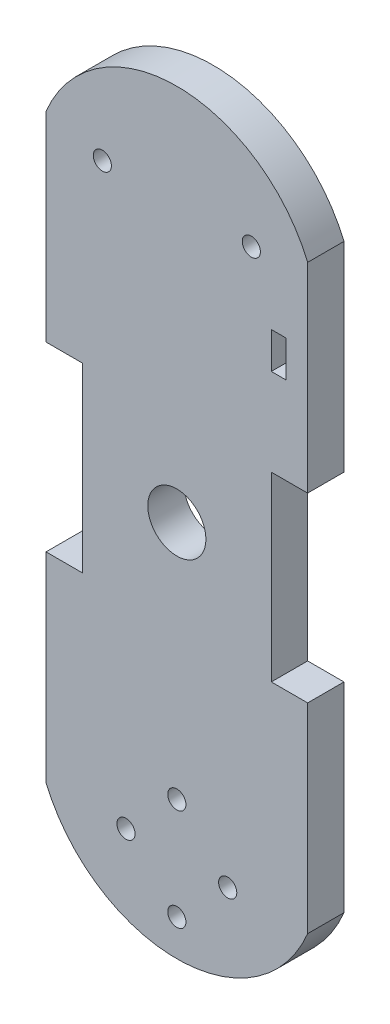
from build123d import *

# Parameters (mm, degrees)
SKETCH1_R           = 1.25
SKETCH1_R_2         = 4
SKETCH1_W           = 2
SKETCH1_H           = 5
BOSS_EXTRUDE1_DEPTH = 5


with BuildPart() as part:
    # Sketch1 → Boss-Extrude1 (new body)
    with BuildSketch(Plane.XY):
        with BuildLine():
            Line((-18, 80), (-18, 52.5))
            Line((-18, 52.5), (-13, 52.5))
            Line((-13, 52.5), (-13, 27.5))
            Line((-13, 27.5), (-18, 27.5))
            Line((-18, 27.5), (-18, 0))
            ThreePointArc((-18, 0), (0, -12), (18, 0))
            Line((18, 0), (18, 27.5))
            Line((18, 27.5), (13, 27.5))
            Line((13, 27.5), (13, 52.5))
            Line((13, 52.5), (18, 52.5))
            Line((18, 52.5), (18, 80))
            ThreePointArc((18, 80), (0, 92), (-18, 80))
        make_face()
        with Locations((0, 7)):
            Circle(SKETCH1_R, mode=Mode.SUBTRACT)
        with Locations((7, 0)):
            Circle(SKETCH1_R, mode=Mode.SUBTRACT)
        with Locations((0, -7)):
            Circle(SKETCH1_R, mode=Mode.SUBTRACT)
        with Locations((-7, 0)):
            Circle(SKETCH1_R, mode=Mode.SUBTRACT)
        with Locations((0, 40)):
            Circle(SKETCH1_R_2, mode=Mode.SUBTRACT)
        with Locations((-10.25, 78)):
            Circle(SKETCH1_R, mode=Mode.SUBTRACT)
        with Locations((10.25, 78)):
            Circle(SKETCH1_R, mode=Mode.SUBTRACT)
        with Locations((14, 67)):
            Rectangle(SKETCH1_W, SKETCH1_H, mode=Mode.SUBTRACT)
    extrude(amount=BOSS_EXTRUDE1_DEPTH)


solid = part.part
